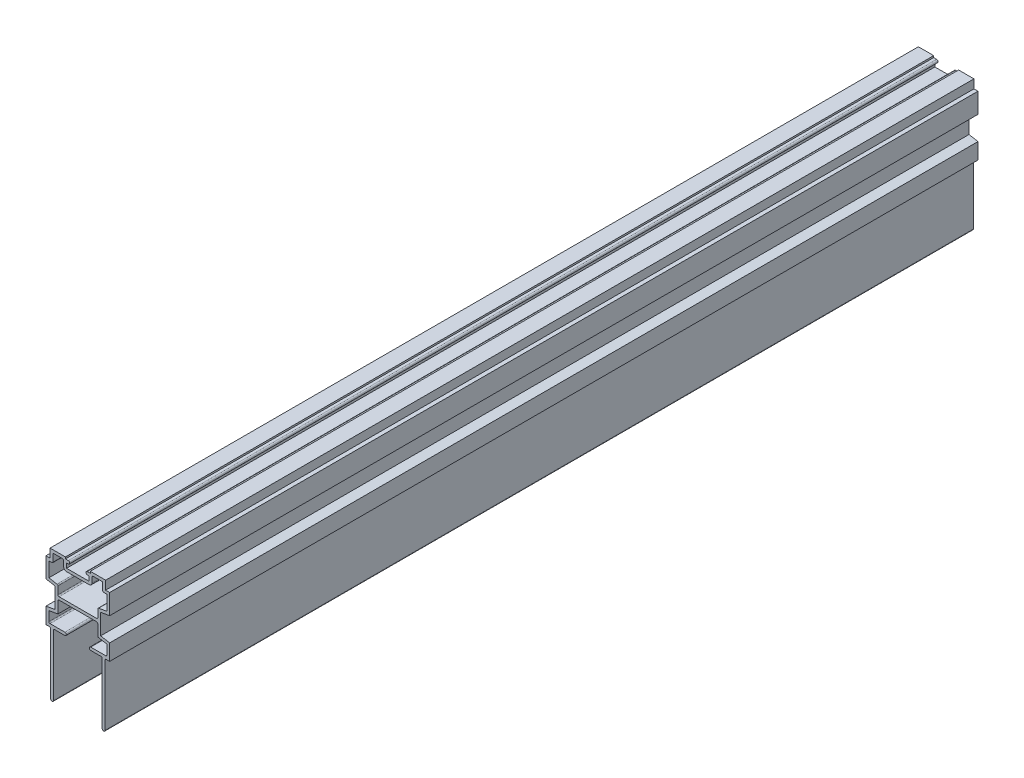
from build123d import *

# Parameters (mm, degrees)
BOSS_EXTRUDE1_DEPTH = 300
FILLET1_R           = 1
FILLET2_R           = 0.3
SKETCH3_W           = 0.4
SKETCH3_H           = 0.6
CUT_EXTRUDE1_DEPTH  = 300
FILLET3_R           = 0.4


with BuildPart() as part:
    # Sketch1 → Boss-Extrude1 (new body)
    with BuildSketch(Plane.XY):
        with BuildLine():
            Line((-3.9, 0), (3.9, 0))
            Line((3.9, 0), (3.9, 1.6))
            Line((3.9, 1.6), (3.3, 1.6))
            ThreePointArc((3.3, 1.6), (2.8, 2.1), (3.3, 2.6))
            Line((3.3, 2.6), (4.3, 2.6))
            Line((4.3, 2.6), (4.3, 3.2))
            Line((4.3, 3.2), (9.6, 3.2))
            Line((9.6, 3.2), (9.6, 0.2))
            Line((9.6, 0.2), (11, 0.2))
            Line((11, 0.2), (11, -6.730696291))
            Line((11, -6.730696291), (7.88474386, -7.28))
            Line((7.88474386, -7.28), (7.88474386, -14.32))
            Line((7.88474386, -14.32), (11, -14.869303709))
            Line((11, -14.869303709), (11, -20.4))
            Line((11, -20.4), (9.8, -20.4))
            ThreePointArc((9.8, -20.4), (9.517157288, -20.517157288), (9.4, -20.8))
            Line((9.4, -20.8), (9.4, -41.8))
            ThreePointArc((9.4, -41.8), (8.9, -42.3), (8.4, -41.8))
            Line((8.4, -41.8), (8.4, -20.8))
            ThreePointArc((8.4, -20.8), (8.282842712, -20.517157288), (8, -20.4))
            Line((8, -20.4), (4.5, -20.4))
            ThreePointArc((4.5, -20.4), (4, -19.9), (4.5, -19.4))
            Line((4.5, -19.4), (8.4, -19.4))
            Line((8.4, -19.4), (9.6, -19.4))
            ThreePointArc((9.6, -19.4), (9.882842712, -19.282842712), (10, -19))
            Line((10, -19), (10, -15.70840334))
            Line((10, -15.70840334), (6.88474386, -15.159099631))
            Line((6.88474386, -15.159099631), (6.88474386, -11.2))
            ThreePointArc((6.88474386, -11.2), (6.767586572, -10.917157288), (6.48474386, -10.8))
            Line((6.48474386, -10.8), (-6.48474386, -10.8))
            ThreePointArc((-6.48474386, -10.8), (-6.767586572, -10.917157288), (-6.88474386, -11.2))
            Line((-6.88474386, -11.2), (-6.88474386, -15.159099631))
            Line((-6.88474386, -15.159099631), (-10, -15.70840334))
            Line((-10, -15.70840334), (-10, -19))
            ThreePointArc((-10, -19), (-9.882842712, -19.282842712), (-9.6, -19.4))
            Line((-9.6, -19.4), (-8.4, -19.4))
            Line((-8.4, -19.4), (-4.5, -19.4))
            ThreePointArc((-4.5, -19.4), (-4, -19.9), (-4.5, -20.4))
            Line((-4.5, -20.4), (-8, -20.4))
            ThreePointArc((-8, -20.4), (-8.282842712, -20.517157288), (-8.4, -20.8))
            Line((-8.4, -20.8), (-8.4, -41.8))
            ThreePointArc((-8.4, -41.8), (-8.9, -42.3), (-9.4, -41.8))
            Line((-9.4, -41.8), (-9.4, -20.8))
            ThreePointArc((-9.4, -20.8), (-9.517157288, -20.517157288), (-9.8, -20.4))
            Line((-9.8, -20.4), (-11, -20.4))
            Line((-11, -20.4), (-11, -14.869303709))
            Line((-11, -14.869303709), (-7.88474386, -14.32))
            Line((-7.88474386, -14.32), (-7.88474386, -7.28))
            Line((-7.88474386, -7.28), (-11, -6.730696291))
            Line((-11, -6.730696291), (-11, 0.2))
            Line((-11, 0.2), (-9.6, 0.2))
            Line((-9.6, 0.2), (-9.6, 3.2))
            Line((-9.6, 3.2), (-4.3, 3.2))
            Line((-4.3, 3.2), (-4.3, 2.6))
            Line((-4.3, 2.6), (-3.3, 2.6))
            ThreePointArc((-3.3, 2.6), (-2.8, 2.1), (-3.3, 1.6))
            Line((-3.3, 1.6), (-3.9, 1.6))
            Line((-3.9, 1.6), (-3.9, 0))
        make_face()
        with BuildLine():
            Line((-6.88474386, -6.440900369), (-6.88474386, -9.4))
            ThreePointArc((-6.88474386, -9.4), (-6.767586572, -9.682842712), (-6.48474386, -9.8))
            Line((-6.48474386, -9.8), (6.48474386, -9.8))
            ThreePointArc((6.48474386, -9.8), (6.767586572, -9.682842712), (6.88474386, -9.4))
            Line((6.88474386, -9.4), (6.88474386, -6.440900369))
            Line((6.88474386, -6.440900369), (10, -5.89159666))
            Line((10, -5.89159666), (10, -0.8))
            Line((10, -0.8), (8.6, -0.8))
            Line((8.6, -0.8), (8.6, 2.2))
            Line((8.6, 2.2), (5.3, 2.2))
            Line((5.3, 2.2), (5.3, 1.6))
            Line((5.3, 1.6), (4.9, 1.6))
            Line((4.9, 1.6), (4.9, -1))
            Line((4.9, -1), (-4.9, -1))
            Line((-4.9, -1), (-4.9, 1.6))
            Line((-4.9, 1.6), (-5.3, 1.6))
            Line((-5.3, 1.6), (-5.3, 2.2))
            Line((-5.3, 2.2), (-8.6, 2.2))
            Line((-8.6, 2.2), (-8.6, -0.8))
            Line((-8.6, -0.8), (-10, -0.8))
            Line((-10, -0.8), (-10, -5.89159666))
            Line((-10, -5.89159666), (-6.88474386, -6.440900369))
        make_face(mode=Mode.SUBTRACT)
    extrude(amount=BOSS_EXTRUDE1_DEPTH)

    # Fillet1
    fillet1_edges = [part.edges().sort_by_distance(p)[0] for p in [
        (4.9, -1, 150),
        (-4.9, -1, 150),
    ]]
    fillet(fillet1_edges, radius=FILLET1_R)

    # Fillet2
    fillet2_edges = [part.edges().sort_by_distance(p)[0] for p in [
        (8.6, -0.8, 150),
        (8.6, 2.2, 150),
        (-8.6, 2.2, 150),
        (-8.6, -0.8, 150),
        (-10, -0.8, 150),
    ]]
    fillet(fillet2_edges, radius=FILLET2_R)

    # Sketch3 → Cut-Extrude1 (cut)
    with BuildSketch(Plane(origin=(0, 0, 0), x_dir=(-1, 0, 0), z_dir=(0, 0, -1))):
        with Locations((5.1, 1.9)):
            Rectangle(SKETCH3_W, SKETCH3_H)
        with Locations((-5.1, 1.9)):
            Rectangle(SKETCH3_W, SKETCH3_H)
    extrude(amount=-CUT_EXTRUDE1_DEPTH, mode=Mode.SUBTRACT)

    # Fillet3
    fillet3_edges = [part.edges().sort_by_distance(p)[0] for p in [
        (-6.88474386, -6.440900369, 150),
        (6.88474386, -6.440900369, 150),
        (-4.9, 2.2, 150),
        (4.9, 2.2, 150),
    ]]
    fillet(fillet3_edges, radius=FILLET3_R)


solid = part.part
